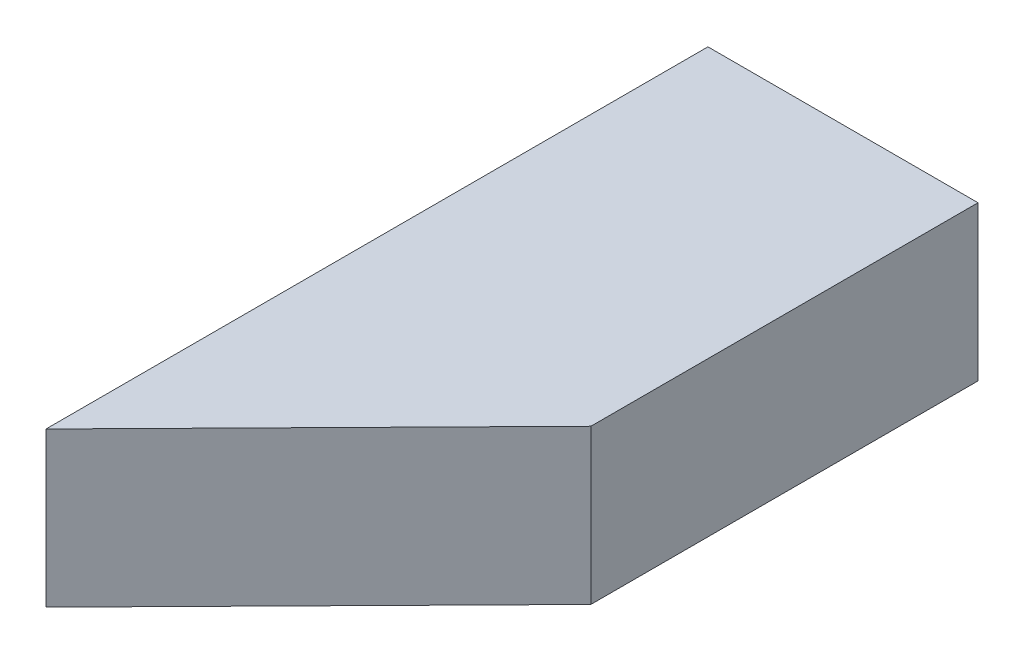
from build123d import *

# Parameters (mm, degrees)
SKETCH2_W           = 88.9
SKETCH2_H           = 50.8
BOSS_EXTRUDE1_DEPTH = 127.42951908
BOSS_EXTRUDE2_DEPTH = 50.8


with BuildPart() as part:
    # Sketch2 → Boss-Extrude1 (new body)
    with BuildSketch(Plane.XY):
        with Locations((44.45, 25.4)):
            Rectangle(SKETCH2_W, SKETCH2_H)
    extrude(amount=BOSS_EXTRUDE1_DEPTH)

    # Sketch3 → Boss-Extrude2 (add)
    with BuildSketch(Plane(origin=(0, 50.8, 0), x_dir=(1, 0, 0), z_dir=(0, 1, 0))):
        Polygon((0, -127.42951908), (0, -217.894816315), (88.9, -127.42951908), align=None)
    extrude(amount=-BOSS_EXTRUDE2_DEPTH)


solid = part.part
